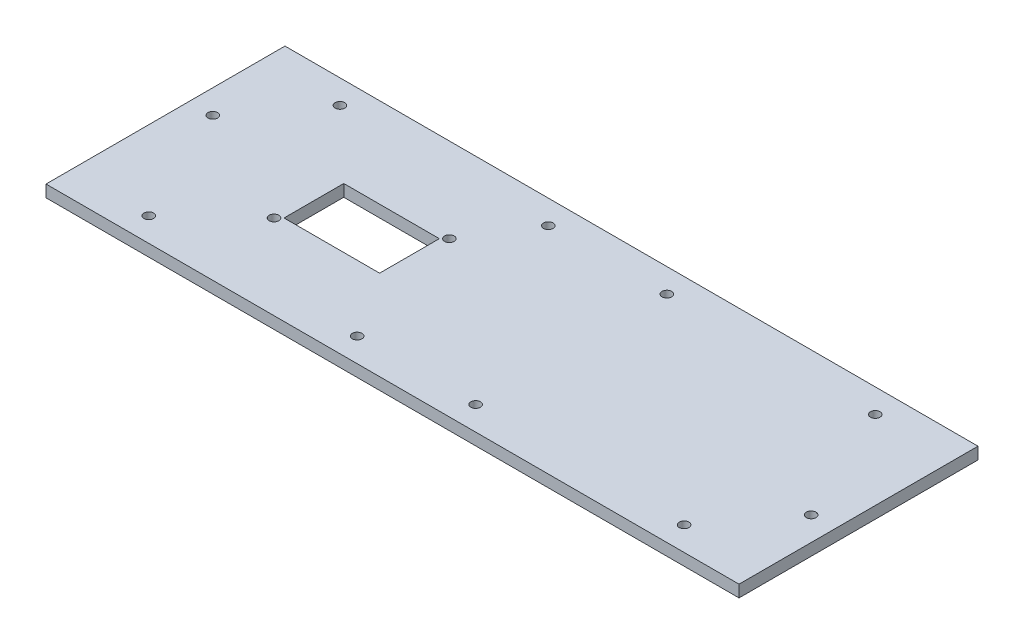
from build123d import *

# Parameters (mm, degrees)
SKETCH1_W           = 368.3
SKETCH1_H           = 127
SKETCH1_R           = 2.5527
BOSS_EXTRUDE1_DEPTH = 6.35
CUT_EXTRUDE1_REACH  = 391.633
SKETCH2_R           = 2.5527
SKETCH2_W           = 50.8
SKETCH2_H           = 31.75


with BuildPart() as part:
    # Sketch1 → Boss-Extrude1 (new body)
    with BuildSketch(Plane(origin=(0, 0, 0), x_dir=(1, 0, 0), z_dir=(0, 1, 0))):
        with Locations((184.15, 63.5)):
            Rectangle(SKETCH1_W, SKETCH1_H)
        with Locations(Location((326.39, 12.7, 0), (0, 0, 270))):
            Circle(SKETCH1_R, mode=Mode.SUBTRACT)
        with Locations(Location((41.91, 12.7, 0), (0, 0, 270))):
            Circle(SKETCH1_R, mode=Mode.SUBTRACT)
        with Locations(Location((41.91, 114.3, 0), (0, 0, 270))):
            Circle(SKETCH1_R, mode=Mode.SUBTRACT)
        with Locations(Location((326.39, 114.3, 0), (0, 0, 270))):
            Circle(SKETCH1_R, mode=Mode.SUBTRACT)
        with Locations(Location((215.646, 12.7, 0), (0, 0, 270))):
            Circle(SKETCH1_R, mode=Mode.SUBTRACT)
        with Locations(Location((152.654, 12.7, 0), (0, 0, 270))):
            Circle(SKETCH1_R, mode=Mode.SUBTRACT)
        with Locations(Location((215.646, 114.3, 0), (0, 0, 270))):
            Circle(SKETCH1_R, mode=Mode.SUBTRACT)
        with Locations(Location((152.654, 114.3, 0), (0, 0, 270))):
            Circle(SKETCH1_R, mode=Mode.SUBTRACT)
        with Locations(Location((12.7, 75.946, 0), (0, 0, 270))):
            Circle(SKETCH1_R, mode=Mode.SUBTRACT)
        with Locations(Location((355.6, 51.054, 0), (0, 0, 270))):
            Circle(SKETCH1_R, mode=Mode.SUBTRACT)
    extrude(amount=BOSS_EXTRUDE1_DEPTH)

    # Sketch2 → Cut-Extrude1 (cut, up to next)
    with BuildSketch(Plane.XZ, mode=Mode.PRIVATE) as cut_extrude1_sk1:
        with Locations(Location((76.2, -44.958, 0), (0, 0, 270))):
            Circle(SKETCH2_R)
    cut_extrude1_tool1 = extrude(cut_extrude1_sk1.sketch, amount=-CUT_EXTRUDE1_REACH, mode=Mode.PRIVATE) & part.part
    # Sketch2 → Cut-Extrude1 (cut, up to next)
    with BuildSketch(Plane.XZ, mode=Mode.PRIVATE) as cut_extrude1_sk2:
        with Locations(Location((132.334, -82.042, 0), (0, 0, 270))):
            Circle(SKETCH2_R)
    cut_extrude1_tool2 = extrude(cut_extrude1_sk2.sketch, amount=-CUT_EXTRUDE1_REACH, mode=Mode.PRIVATE) & part.part
    # Sketch2 → Cut-Extrude1 (cut, up to next)
    with BuildSketch(Plane.XZ, mode=Mode.PRIVATE) as cut_extrude1_sk3:
        with Locations((104.267, -63.5)):
            Rectangle(SKETCH2_W, SKETCH2_H)
    cut_extrude1_tool3 = extrude(cut_extrude1_sk3.sketch, amount=-CUT_EXTRUDE1_REACH, mode=Mode.PRIVATE) & part.part
    add(cut_extrude1_tool1.solids().sort_by_distance((76.2, 0, -44.958))[0], mode=Mode.SUBTRACT)
    add(cut_extrude1_tool2.solids().sort_by_distance((132.334, 0, -82.042))[0], mode=Mode.SUBTRACT)
    add(cut_extrude1_tool3.solids().sort_by_distance((104.267, 0, -63.5))[0], mode=Mode.SUBTRACT)


solid = part.part
